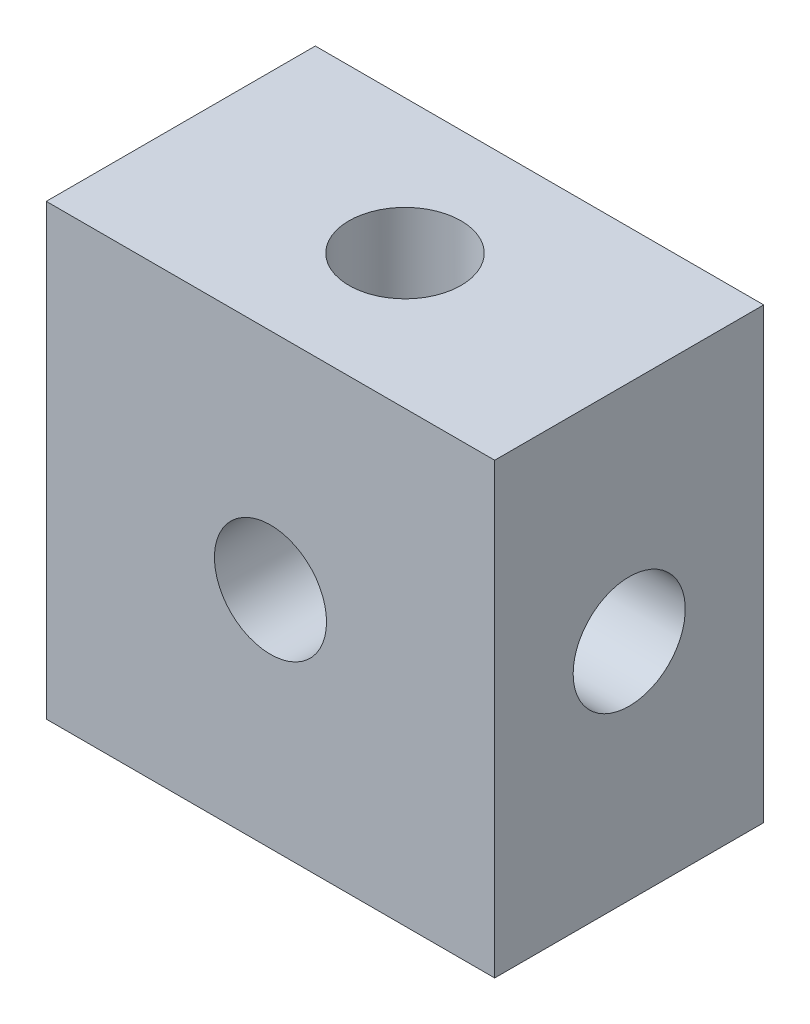
from build123d import *

# Parameters (mm, degrees)
SKETCH_1_W         = 10
SKETCH_1_H         = 10
EXTRUDE_1_DEPTH    = 3
HOLE_WIZARD_M3_1_D = 2.5
HOLE_WIZARD_M3_2_D = 2.5
HOLE_WIZARD_M3_3_D = 2.5


with BuildPart() as part:
    # 草图1 → 凸台-拉伸1 (new, symmetric)
    with BuildSketch(Plane.XY):
        Rectangle(SKETCH_1_W, SKETCH_1_H)
    extrude(amount=EXTRUDE_1_DEPTH, both=True)

    # M3 螺纹孔1 (through all)
    with Locations(Plane.ZY.offset(5)):
        with Locations((0, 0)):
            Hole(HOLE_WIZARD_M3_1_D / 2)

    # M3 螺纹孔2 (through all)
    with Locations(Plane.XY.offset(3)):
        with Locations((0, 0)):
            Hole(HOLE_WIZARD_M3_2_D / 2)

    # M3 螺纹孔3 (through all)
    with Locations(Plane(origin=(0, -5, 0), x_dir=(-1, 0, 0), z_dir=(0, -1, 0))):
        with Locations((0, 0)):
            Hole(HOLE_WIZARD_M3_3_D / 2)


solid = part.part
